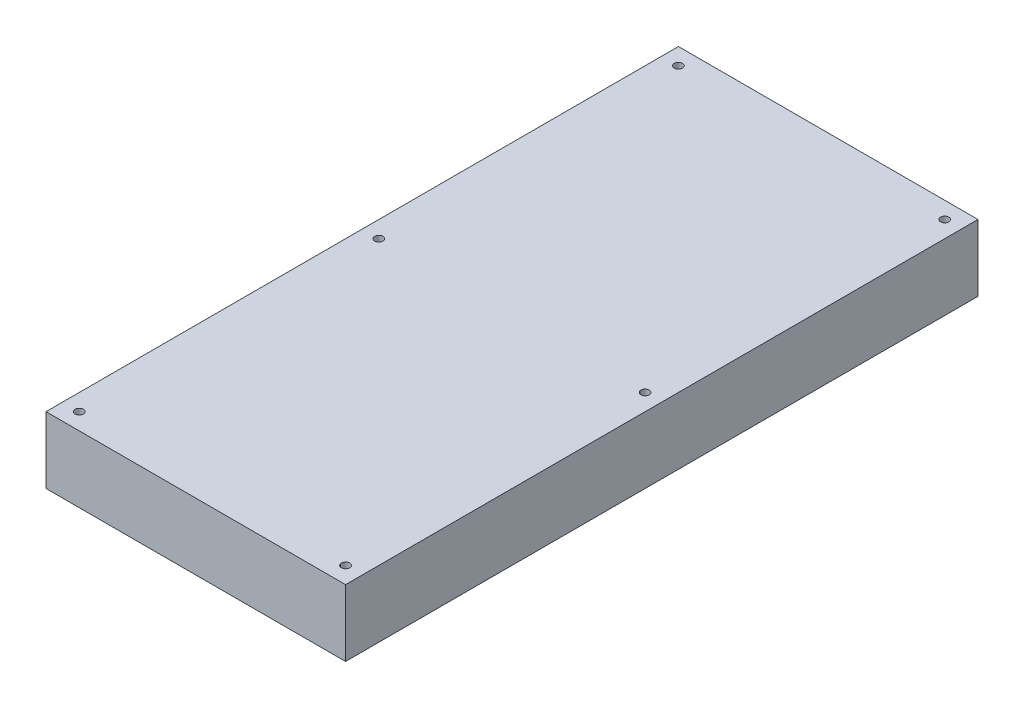
from build123d import *

# Parameters (mm, degrees)
SKETCH1_W           = 90
SKETCH1_H           = 190
BOSS_EXTRUDE1_DEPTH = 10
SKETCH2_R           = 1.25
CUT_EXTRUDE2_DEPTH  = 108.004672795


with BuildPart() as part:
    # Sketch1 → Boss-Extrude1 (new, symmetric)
    with BuildSketch(Plane(origin=(0, 0, 0), x_dir=(1, 0, 0), z_dir=(0, 1, 0))):
        Rectangle(SKETCH1_W, SKETCH1_H)
    extrude(amount=BOSS_EXTRUDE1_DEPTH, both=True)

    # Sketch2 → Cut-Extrude2 (cut, through all)
    with BuildSketch(Plane(origin=(0, 10, 0), x_dir=(1, 0, 0), z_dir=(0, 1, 0))):
        with Locations((-40, -90)):
            Circle(SKETCH2_R)
        with Locations((40, -90)):
            Circle(SKETCH2_R)
        with Locations((-40, 0)):
            Circle(SKETCH2_R)
        with Locations((-40, 90)):
            Circle(SKETCH2_R)
        with Locations((40, 90)):
            Circle(SKETCH2_R)
        with Locations((40, 0)):
            Circle(SKETCH2_R)
    extrude(amount=-CUT_EXTRUDE2_DEPTH, mode=Mode.SUBTRACT)


solid = part.part
